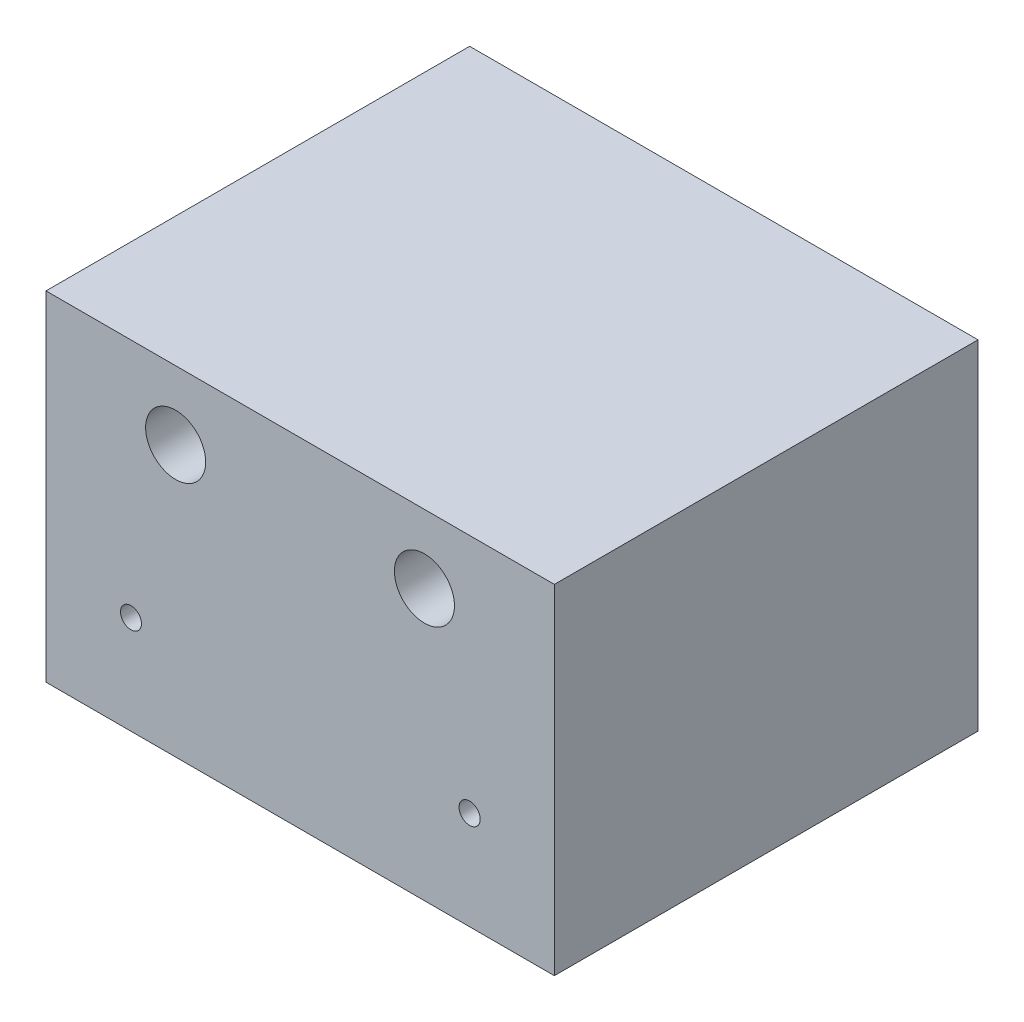
from build123d import *

# Parameters (mm, degrees)
SKETCH2_W           = 152.4
SKETCH2_H           = 101.6
SKETCH2_R           = 8.9999947
SKETCH2_R_2         = 3.175
SKETCH2_R_3         = 3.142219065
BOSS_EXTRUDE1_DEPTH = 127


with BuildPart() as part:
    # Sketch2 → Boss-Extrude1 (new body)
    with BuildSketch(Plane.XY):
        with Locations((-76.2, 50.8)):
            Rectangle(SKETCH2_W, SKETCH2_H)
        with Locations((-113.538, 81.061351085)):
            Circle(SKETCH2_R, mode=Mode.SUBTRACT)
        with Locations((-38.952133661, 81.061351085)):
            Circle(SKETCH2_R, mode=Mode.SUBTRACT)
        with Locations((-25.4, 29.483717051)):
            Circle(SKETCH2_R_2, mode=Mode.SUBTRACT)
        with Locations((-126.923613039, 29.483717051)):
            Circle(SKETCH2_R_3, mode=Mode.SUBTRACT)
    extrude(amount=BOSS_EXTRUDE1_DEPTH)


solid = part.part
